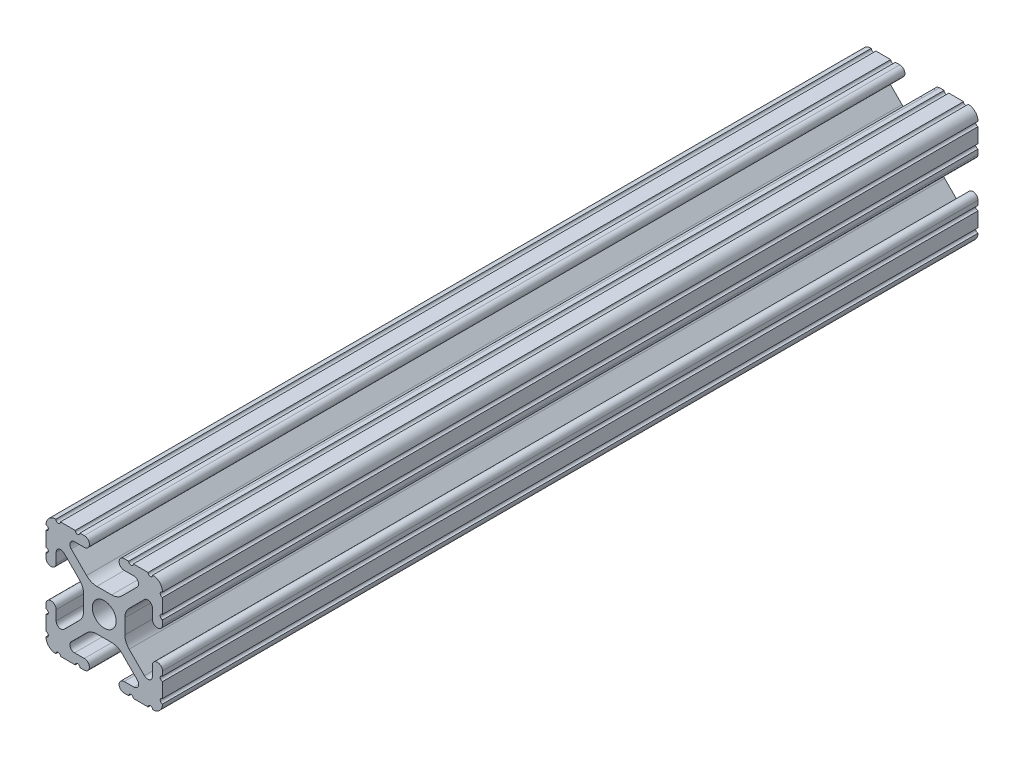
from build123d import *

# Parameters (mm, degrees)
SKETCH1_R           = 2.6035
BOSS_EXTRUDE1_DEPTH = 177.8


with BuildPart() as part:
    # Sketch1 → Boss-Extrude1 (new body)
    with BuildSketch(Plane(origin=(0, 0, -25.4), x_dir=(-1, 0, 0), z_dir=(0, 0, -1))):
        with BuildLine():
            Line((12.7, -9.5504), (12.7, -6.3330836))
            ThreePointArc((12.7, -6.3330836), (12.192, -5.8250836), (12.7, -5.3170836))
            Line((12.7, -5.3170836), (12.7, -4.3434))
            ThreePointArc((12.7, -4.3434), (11.5951, -3.2385), (10.4902, -4.3434))
            Line((10.4902, -4.3434), (10.4902, -6.474794456))
            ThreePointArc((10.4902, -6.474794456), (9.863006367, -7.413456061), (8.75577951, -7.193214945))
            Line((8.75577951, -7.193214945), (5.42573597, -3.863171405))
            ThreePointArc((5.42573597, -3.863171405), (4.737482484, -2.833127272), (4.4958, -1.618107374))
            Line((4.4958, -1.618107374), (4.4958, 1.618107374))
            ThreePointArc((4.4958, 1.618107374), (4.737482484, 2.833127272), (5.42573597, 3.863171405))
            Line((5.42573597, 3.863171405), (8.75577951, 7.193214945))
            ThreePointArc((8.75577951, 7.193214945), (9.863006367, 7.413456061), (10.4902, 6.474794456))
            Line((10.4902, 6.474794456), (10.4902, 4.343399971))
            ThreePointArc((10.4902, 4.343399971), (11.5951, 3.238499971), (12.7, 4.343399971))
            Line((12.7, 4.343399971), (12.7, 5.3170836))
            ThreePointArc((12.7, 5.3170836), (12.192, 5.8250836), (12.7, 6.3330836))
            Line((12.7, 6.3330836), (12.7, 9.5504))
            ThreePointArc((12.7, 9.5504), (12.192000006, 10.058323491), (12.699846982, 10.566399977))
            ThreePointArc((12.699846982, 10.566399977), (12.082522516, 12.082522516), (10.566399977, 12.699846982))
            ThreePointArc((10.566399977, 12.699846982), (10.058323491, 12.192000006), (9.5504, 12.7))
            Line((9.5504, 12.7), (6.3330836, 12.7))
            ThreePointArc((6.3330836, 12.7), (5.8250836, 12.192), (5.3170836, 12.7))
            Line((5.3170836, 12.7), (4.3434, 12.7))
            ThreePointArc((4.3434, 12.7), (3.2385, 11.5951), (4.3434, 10.4902))
            Line((4.3434, 10.4902), (6.474794456, 10.4902))
            ThreePointArc((6.474794456, 10.4902), (7.413456061, 9.863006367), (7.193214945, 8.75577951))
            Line((7.193214945, 8.75577951), (3.863171405, 5.42573597))
            ThreePointArc((3.863171405, 5.42573597), (2.833127272, 4.737482484), (1.618107374, 4.4958))
            Line((1.618107374, 4.4958), (-1.618107374, 4.4958))
            ThreePointArc((-1.618107374, 4.4958), (-2.833127272, 4.737482484), (-3.863171405, 5.42573597))
            Line((-3.863171405, 5.42573597), (-7.193214945, 8.75577951))
            ThreePointArc((-7.193214945, 8.75577951), (-7.413456061, 9.863006367), (-6.474794456, 10.4902))
            Line((-6.474794456, 10.4902), (-4.343399971, 10.4902))
            ThreePointArc((-4.343399971, 10.4902), (-3.238499971, 11.5951), (-4.343399971, 12.7))
            Line((-4.343399971, 12.7), (-5.3170836, 12.7))
            ThreePointArc((-5.3170836, 12.7), (-5.8250836, 12.192), (-6.3330836, 12.7))
            Line((-6.3330836, 12.7), (-9.5504, 12.7))
            ThreePointArc((-9.5504, 12.7), (-10.058323491, 12.192000006), (-10.566399977, 12.699846982))
            ThreePointArc((-10.566399977, 12.699846982), (-12.082522516, 12.082522516), (-12.699846982, 10.566399977))
            ThreePointArc((-12.699846982, 10.566399977), (-12.192000006, 10.058323491), (-12.7, 9.5504))
            Line((-12.7, 9.5504), (-12.7, 6.3330836))
            ThreePointArc((-12.7, 6.3330836), (-12.192, 5.8250836), (-12.7, 5.3170836))
            Line((-12.7, 5.3170836), (-12.7, 4.3434))
            ThreePointArc((-12.7, 4.3434), (-11.5951, 3.2385), (-10.4902, 4.3434))
            Line((-10.4902, 4.3434), (-10.4902, 6.474794456))
            ThreePointArc((-10.4902, 6.474794456), (-9.863006367, 7.413456061), (-8.75577951, 7.193214945))
            Line((-8.75577951, 7.193214945), (-5.42573597, 3.863171405))
            ThreePointArc((-5.42573597, 3.863171405), (-4.737482484, 2.833127272), (-4.4958, 1.618107374))
            Line((-4.4958, 1.618107374), (-4.4958, -1.618107374))
            ThreePointArc((-4.4958, -1.618107374), (-4.737482484, -2.833127272), (-5.42573597, -3.863171405))
            Line((-5.42573597, -3.863171405), (-8.75577951, -7.193214945))
            ThreePointArc((-8.75577951, -7.193214945), (-9.863006367, -7.413456061), (-10.4902, -6.474794456))
            Line((-10.4902, -6.474794456), (-10.4902, -4.343399971))
            ThreePointArc((-10.4902, -4.343399971), (-11.5951, -3.238499971), (-12.7, -4.343399971))
            Line((-12.7, -4.343399971), (-12.7, -5.3170836))
            ThreePointArc((-12.7, -5.3170836), (-12.192, -5.8250836), (-12.7, -6.3330836))
            Line((-12.7, -6.3330836), (-12.7, -9.5504))
            ThreePointArc((-12.7, -9.5504), (-12.192000006, -10.058323491), (-12.699846982, -10.566399977))
            ThreePointArc((-12.699846982, -10.566399977), (-12.082522516, -12.082522516), (-10.566399977, -12.699846982))
            ThreePointArc((-10.566399977, -12.699846982), (-10.058323491, -12.192000006), (-9.5504, -12.7))
            Line((-9.5504, -12.7), (-6.3330836, -12.7))
            ThreePointArc((-6.3330836, -12.7), (-5.8250836, -12.192), (-5.3170836, -12.7))
            Line((-5.3170836, -12.7), (-4.3434, -12.7))
            ThreePointArc((-4.3434, -12.7), (-3.2385, -11.5951), (-4.3434, -10.4902))
            Line((-4.3434, -10.4902), (-6.474794456, -10.4902))
            ThreePointArc((-6.474794456, -10.4902), (-7.413456061, -9.863006367), (-7.193214945, -8.75577951))
            Line((-7.193214945, -8.75577951), (-3.863171405, -5.42573597))
            ThreePointArc((-3.863171405, -5.42573597), (-2.833127272, -4.737482484), (-1.618107374, -4.4958))
            Line((-1.618107374, -4.4958), (1.618107374, -4.4958))
            ThreePointArc((1.618107374, -4.4958), (2.833127272, -4.737482484), (3.863171405, -5.42573597))
            Line((3.863171405, -5.42573597), (7.193214945, -8.75577951))
            ThreePointArc((7.193214945, -8.75577951), (7.413456061, -9.863006367), (6.474794456, -10.4902))
            Line((6.474794456, -10.4902), (4.343399971, -10.4902))
            ThreePointArc((4.343399971, -10.4902), (3.238499971, -11.5951), (4.343399971, -12.7))
            Line((4.343399971, -12.7), (5.3170836, -12.7))
            ThreePointArc((5.3170836, -12.7), (5.8250836, -12.192), (6.3330836, -12.7))
            Line((6.3330836, -12.7), (9.5504, -12.7))
            ThreePointArc((9.5504, -12.7), (10.058323491, -12.192000006), (10.566399977, -12.699846982))
            ThreePointArc((10.566399977, -12.699846982), (12.082522516, -12.082522516), (12.699846982, -10.566399977))
            ThreePointArc((12.699846982, -10.566399977), (12.192000006, -10.058323491), (12.7, -9.5504))
        make_face()
        with Locations(Location((0, 0, 0), (0, 0, 180))):
            Circle(SKETCH1_R, mode=Mode.SUBTRACT)
    extrude(amount=BOSS_EXTRUDE1_DEPTH)


solid = part.part
